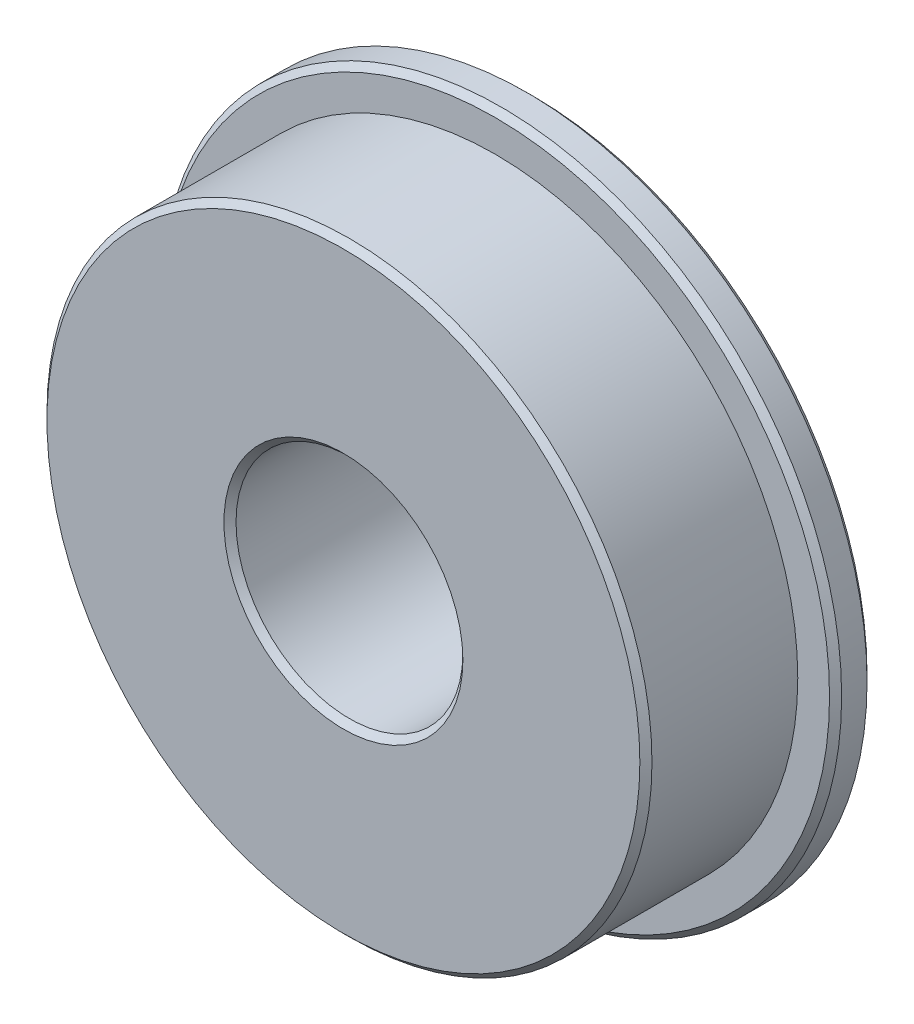
from build123d import *


with BuildPart() as part:
    # Sketch1 → Revolve1 (revolve)
    with BuildSketch(Plane(origin=(0, 6.041958042, 0), x_dir=(-1, 0, 0), z_dir=(0, 1, 0))):
        Polygon((-5.171961538, 7.9502), (-5.425961538, 7.6962), (-5.425961538, 1.5748), (-6.759461538, 1.5748), (-7.013461538, 1.3208), (-7.013461538, 0.254), (-6.759461538, 0), (2.257538462, 0), (2.511538462, 0.254), (2.511538462, 7.6962), (2.257538462, 7.9502), align=None)
    revolve(axis=Axis((-7.274038462, 6.041958042, 0), (0, 0, 1)))


solid = part.part
